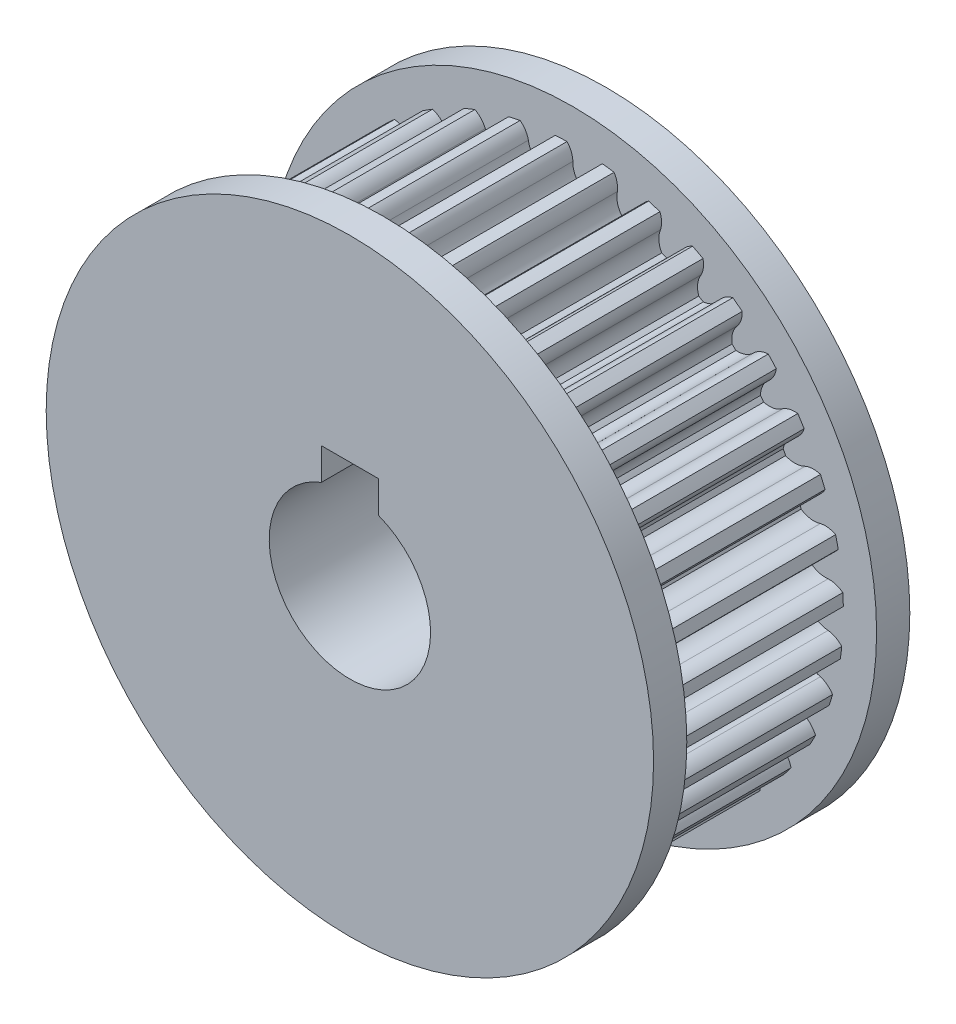
from build123d import *

# Parameters (mm, degrees)
CROQUIS2_R              = 28.5
SALIENTE_EXTRUIR2_DEPTH = 20
CORTAR_EXTRUIR2_START   = -23
CORTAR_EXTRUIR2_DEPTH   = 23
MATRIZC1_COUNT          = 36
CORTAR_EXTRUIR3_DEPTH   = 46
SALIENTE_EXTRUIR3_START = 3.5
CROQUIS7_R              = 28.5
SALIENTE_EXTRUIR3_DEPTH = 3.5
CROQUIS8_R              = 28.5
SALIENTE_EXTRUIR4_DEPTH = 3.5
CROQUIS10_R             = 32
CROQUIS10_R_2           = 28.5
SALIENTE_EXTRUIR5_DEPTH = 3.5
SALIENTE_EXTRUIR6_START = -3.5
CROQUIS11_R             = 32
CROQUIS11_R_2           = 28.5
SALIENTE_EXTRUIR6_DEPTH = 3.5


with BuildPart() as part:
    # Croquis2 → Saliente-Extruir2 (new body)
    with BuildSketch(Plane.XY):
        Circle(CROQUIS2_R)
    extrude(amount=SALIENTE_EXTRUIR2_DEPTH)

    # Croquis5 → Cortar-Extruir2 (cut)
    with BuildSketch(Plane.XY.offset(20).offset(CORTAR_EXTRUIR2_START)):
        with BuildLine():
            ThreePointArc((1.3772228, 25.087225481), (2.073847361, 25.879907984), (2.354753698, 26.897121315))
            ThreePointArc((2.354753698, 26.897121315), (2.602135898, 27.680023505), (3.103062535, 28.330566583))
            ThreePointArc((3.103062535, 28.330566583), (1.243972222, 28.472838515), (-0.620442335, 28.493245714))
            ThreePointArc((-0.620442335, 28.493245714), (-0.178160268, 27.801494049), (0, 27))
            ThreePointArc((0, 27), (0.191121665, 25.962163867), (0.815959564, 25.111746952))
            ThreePointArc((0.815959564, 25.111746952), (1.096659722, 25.101055007), (1.3772228, 25.087225481))
        make_face()
    cortar_extruir2 = extrude(amount=CORTAR_EXTRUIR2_DEPTH, mode=Mode.SUBTRACT)

    # MatrizC1: Cortar-Extruir2 ×36 about axis
    matrizc1_axis = Axis((0, 0, 0), (0, 0, 1))
    for i in range(1, MATRIZC1_COUNT):
        add(cortar_extruir2.rotate(matrizc1_axis, i * 360 / MATRIZC1_COUNT), mode=Mode.SUBTRACT)

    # Croquis6 → Cortar-Extruir3 (cut)
    with BuildSketch(Plane.XY.offset(20)):
        with BuildLine():
            Line((3, 7.95298686), (3, 11.30298686))
            Line((3, 11.30298686), (-3, 11.30298686))
            Line((-3, 11.30298686), (-3, 7.95298686))
            ThreePointArc((-3, 7.95298686), (0, -8.5), (3, 7.95298686))
        make_face()
    extrude(amount=-CORTAR_EXTRUIR3_DEPTH, mode=Mode.SUBTRACT)

    # Croquis7 → Saliente-Extruir3 (add)
    with BuildSketch(Plane(origin=(0, 0, 0), x_dir=(-1, 0, 0), z_dir=(0, 0, -1)).offset(SALIENTE_EXTRUIR3_START)):
        Circle(CROQUIS7_R)
        with BuildLine():
            Line((-3, 7.95298686), (-3, 11.30298686))
            Line((-3, 11.30298686), (3, 11.30298686))
            Line((3, 11.30298686), (3, 7.95298686))
            ThreePointArc((3, 7.95298686), (0, -8.5), (-3, 7.95298686))
        make_face(mode=Mode.SUBTRACT)
    extrude(amount=-SALIENTE_EXTRUIR3_DEPTH)

    # Croquis8 → Saliente-Extruir4 (add)
    with BuildSketch(Plane.XY.offset(20)):
        with Locations(Location((0, 0, 0), (0, 0, 180))):
            Circle(CROQUIS8_R)
        with BuildLine():
            Line((3, 7.95298686), (3, 11.30298686))
            Line((3, 11.30298686), (-3, 11.30298686))
            Line((-3, 11.30298686), (-3, 7.95298686))
            ThreePointArc((-3, 7.95298686), (0, -8.5), (3, 7.95298686))
        make_face(mode=Mode.SUBTRACT)
    extrude(amount=SALIENTE_EXTRUIR4_DEPTH)

    # Croquis10 → Saliente-Extruir5 (add)
    with BuildSketch(Plane(origin=(0, 0, 20), x_dir=(-1, 0, 0), z_dir=(0, 0, -1))):
        Circle(CROQUIS10_R)
        Circle(CROQUIS10_R_2, mode=Mode.SUBTRACT)
    extrude(amount=-SALIENTE_EXTRUIR5_DEPTH)

    # Croquis11 → Saliente-Extruir6 (add)
    with BuildSketch(Plane.XY.offset(SALIENTE_EXTRUIR6_START)):
        with Locations(Location((0, 0, 0), (0, 0, 180))):
            Circle(CROQUIS11_R)
        Circle(CROQUIS11_R_2, mode=Mode.SUBTRACT)
    extrude(amount=SALIENTE_EXTRUIR6_DEPTH)


solid = part.part
